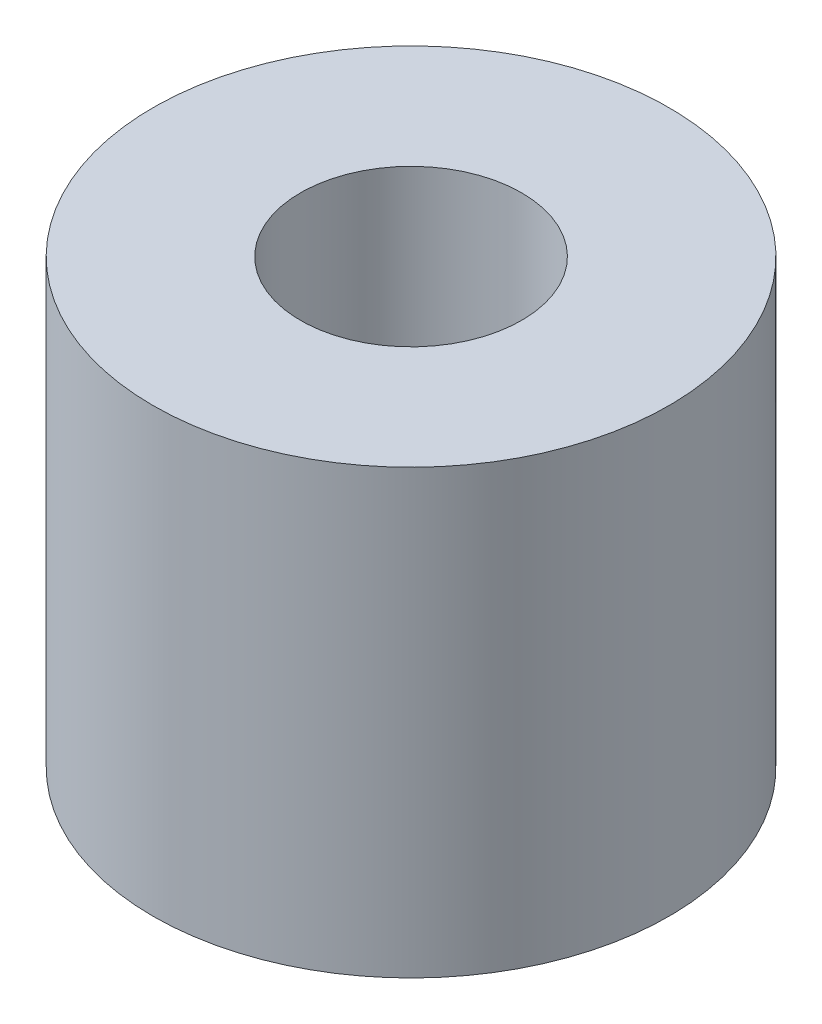
from build123d import *

# Parameters (mm, degrees)
ESQUISSE1_R             = 17.5
BOSS_EXTRU_1_DEPTH      = 30
ESQUISSE2_R             = 7.5
ENL_V_MAT_EXTRU_1_DEPTH = 30


with BuildPart() as part:
    # Esquisse1 → Boss.-Extru.1 (new body)
    with BuildSketch(Plane(origin=(0, 0, 0), x_dir=(1, 0, 0), z_dir=(0, 1, 0))):
        with Locations(Location((0, 0, 0), (0, 0, 270))):
            Circle(ESQUISSE1_R)
    extrude(amount=BOSS_EXTRU_1_DEPTH)

    # Esquisse2 → Enlèv. mat.-Extru.1 (cut)
    with BuildSketch(Plane.XZ):
        with Locations(Location((0, 0, 0), (0, 0, 270))):
            Circle(ESQUISSE2_R)
    extrude(amount=-ENL_V_MAT_EXTRU_1_DEPTH, mode=Mode.SUBTRACT)


solid = part.part
